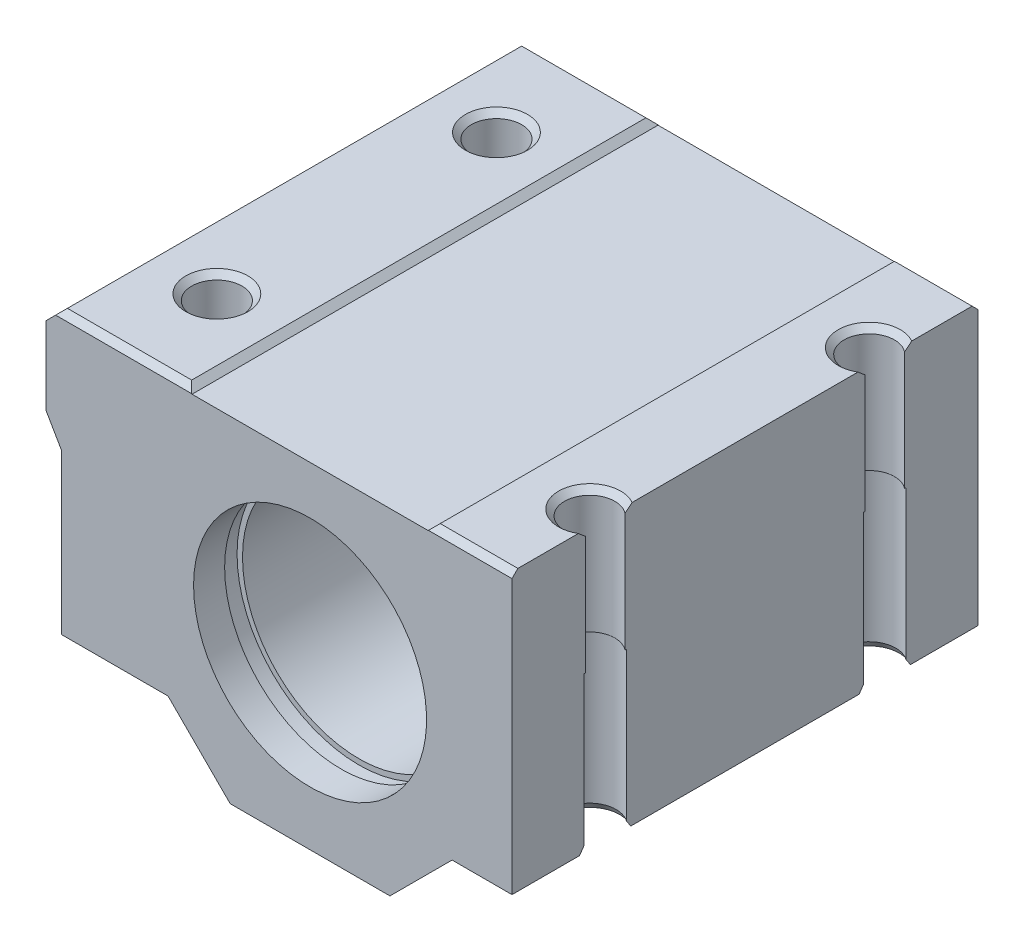
from build123d import *
from OCP.BRepFilletAPI import BRepFilletAPI_MakeChamfer

# Parameters (mm, degrees)
SCHIZZO1_W                   = 34
SCHIZZO1_H                   = 30
ESTRUSIONE_ESTRUSIONE1_DEPTH = 22
SCHIZZO2_W                   = 1
SCHIZZO2_H                   = 14.267949192
TAGLIO_ESTRUSIONE1_DEPTH     = 37.193922142
SCHIZZO3_W                   = 10.8571
SCHIZZO3_H                   = 4
TAGLIO_ESTRUSIONE2_DEPTH     = 37.193922142
SCHIZZO4_W                   = 11.8571
SCHIZZO4_H                   = 4
TAGLIO_ESTRUSIONE3_DEPTH     = 37.193922142
SCHIZZO5_W                   = 1
SCHIZZO5_H                   = 10.267949192
TAGLIO_ESTRUSIONE4_DEPTH     = 37.193922142
SCHIZZO6_W                   = 15.2
SCHIZZO6_H                   = 0.4
TAGLIO_ESTRUSIONE5_DEPTH     = 37.193922142
SFORMO1_ANGLE                = 60
SFORMO2_ANGLE                = 60
SFORMO3_ANGLE                = 45
SFORMO4_ANGLE                = 45
SMUSSO1_SIZE                 = 0.230940108
SMUSSO1_SIZE2                = 0.4
SMUSSO2_SIZE                 = 0.379
SMUSSO3_SIZE                 = 1
SCHIZZO13_W                  = 7.577824215
SCHIZZO13_H                  = 21.931685432
TAGLIO_ESTRUSIONE6_DEPTH     = 37.193922142


with BuildPart() as part:
    # Schizzo1 → Estrusione-Estrusione1 (new body)
    with BuildSketch(Plane(origin=(0, 11, 0), x_dir=(1, 0, 0), z_dir=(0, 1, 0))):
        with Locations((0, -15)):
            Rectangle(SCHIZZO1_W, SCHIZZO1_H)
    extrude(amount=-ESTRUSIONE_ESTRUSIONE1_DEPTH)

    # Schizzo2 → Taglio-Estrusione1 (cut, through all)
    with BuildSketch(Plane.XY.offset(30)):
        with Locations((16.5, -3.866025404)):
            Rectangle(SCHIZZO2_W, SCHIZZO2_H)
    extrude(amount=-TAGLIO_ESTRUSIONE1_DEPTH, mode=Mode.SUBTRACT)

    # Schizzo3 → Taglio-Estrusione2 (cut, through all)
    with BuildSketch(Plane.XY.offset(30)):
        with Locations((10.57145, -9)):
            Rectangle(SCHIZZO3_W, SCHIZZO3_H)
    extrude(amount=-TAGLIO_ESTRUSIONE2_DEPTH, mode=Mode.SUBTRACT)

    # Schizzo4 → Taglio-Estrusione3 (cut, through all)
    with BuildSketch(Plane.XY.offset(30)):
        with Locations((-11.07145, -9)):
            Rectangle(SCHIZZO4_W, SCHIZZO4_H)
    extrude(amount=-TAGLIO_ESTRUSIONE3_DEPTH, mode=Mode.SUBTRACT)

    # Schizzo5 → Taglio-Estrusione4 (cut, through all)
    with BuildSketch(Plane.XY.offset(30)):
        with Locations((-16.5, -1.866025404)):
            Rectangle(SCHIZZO5_W, SCHIZZO5_H)
    extrude(amount=-TAGLIO_ESTRUSIONE4_DEPTH, mode=Mode.SUBTRACT)

    # Schizzo6 → Taglio-Estrusione5 (cut, through all)
    with BuildSketch(Plane.XY.offset(30)):
        with Locations((0, 10.8)):
            Rectangle(SCHIZZO6_W, SCHIZZO6_H)
    extrude(amount=-TAGLIO_ESTRUSIONE5_DEPTH, mode=Mode.SUBTRACT)

    # Sformo1
    sformo1_faces = [part.faces().sort_by_distance(p)[0] for p in [
        (16.5, 3.267949192, 15),
    ]]
    draft(sformo1_faces, Plane(origin=(16, 3.267949192, 0), x_dir=(0, 0, 1), z_dir=(1, 0, 0)), SFORMO1_ANGLE)

    # Sformo2
    sformo2_faces = [part.faces().sort_by_distance(p)[0] for p in [
        (-16.5, 3.267949192, 15),
    ]]
    draft(sformo2_faces, Plane(origin=(-16, -7, 0), x_dir=(0, 0, -1), z_dir=(-1, 0, 0)), SFORMO2_ANGLE)

    # Sformo3
    sformo3_faces = [part.faces().sort_by_distance(p)[0] for p in [
        (5.1429, -9, 15),
        (-5.1429, -9, 15),
    ]]
    draft(sformo3_faces, Plane(origin=(0, -11, 0), x_dir=(0, 0, -1), z_dir=(0, -1, 0)), SFORMO3_ANGLE)

    # Sformo4
    sformo4_faces = [part.faces().sort_by_distance(p)[0] for p in [
        (-7.6, 10.8, 15),
        (7.6, 10.8, 15),
    ]]
    draft(sformo4_faces, Plane(origin=(-7.6, 10.6, 0), x_dir=(1, 0, 0), z_dir=(0, 1, 0)), SFORMO4_ANGLE)

    # Schizzo7 → Taglia-Rivoluzione1 (revolve, cut)
    with BuildSketch(Plane.XZ, mode=Mode.PRIVATE) as taglia_rivoluzione1_sk:
        Polygon((7.5, 30), (0, 30), (0, 0), (7.5, 0), (7.5, 2), (7.85, 2), (7.85, 3.15), (7.5, 3.15), (7.5, 26.85), (7.85, 26.85), (7.85, 28), (7.5, 28), align=None)
    revolve(taglia_rivoluzione1_sk.sketch.rotate(Axis((0, 0, 30), (0, 0, -1)), 180), axis=Axis((0, 0, 30), (0, 0, -1)), mode=Mode.SUBTRACT)

    # Schizzo8 → Taglia-Rivoluzione2 (revolve, cut)
    with BuildSketch(Plane.XY.offset(6), mode=Mode.PRIVATE) as taglia_rivoluzione2_sk:
        Polygon((-10.379, 11), (-12, 11), (-12, -7), (-10.3, -7), (-10.3, 3), (-10.379, 3), align=None)
    revolve(taglia_rivoluzione2_sk.sketch.rotate(Axis((-12, 11, 6), (0, -1, 0)), 270), axis=Axis((-12, 11, 6), (0, -1, 0)), mode=Mode.SUBTRACT)

    # Schizzo9 → Taglia-Rivoluzione3 (revolve, cut)
    with BuildSketch(Plane.XY.offset(24), mode=Mode.PRIVATE) as taglia_rivoluzione3_sk:
        Polygon((-10.379, 11), (-12, 11), (-12, -7), (-10.3, -7), (-10.3, 3), (-10.379, 3), align=None)
    revolve(taglia_rivoluzione3_sk.sketch.rotate(Axis((-12, 11, 24), (0, -1, 0)), 270), axis=Axis((-12, 11, 24), (0, -1, 0)), mode=Mode.SUBTRACT)

    # Schizzo10 → Taglia-Rivoluzione4 (revolve, cut)
    with BuildSketch(Plane.XY.offset(6), mode=Mode.PRIVATE) as taglia_rivoluzione4_sk:
        Polygon((13.621, 11), (12, 11), (12, -7), (13.7, -7), (13.7, 3), (13.621, 3), align=None)
    revolve(taglia_rivoluzione4_sk.sketch.rotate(Axis((12, 11, 6), (0, -1, 0)), 270), axis=Axis((12, 11, 6), (0, -1, 0)), mode=Mode.SUBTRACT)

    # Schizzo11 → Taglia-Rivoluzione5 (revolve, cut)
    with BuildSketch(Plane.XY.offset(24), mode=Mode.PRIVATE) as taglia_rivoluzione5_sk:
        Polygon((13.621, 11), (12, 11), (12, -7), (13.7, -7), (13.7, 3), (13.621, 3), align=None)
    revolve(taglia_rivoluzione5_sk.sketch.rotate(Axis((12, 11, 24), (0, -1, 0)), 270), axis=Axis((12, 11, 24), (0, -1, 0)), mode=Mode.SUBTRACT)

    # Smusso1: one chamfer whose edges measure the first distance from different faces: ONE call of the kernel's chamfer builder (chamfer() names one face for all edges)
    smusso1_edges_1 = [part.edges().sort_by_distance(p)[0] for p in [
        (-12, -7, 7.7),
        (-12, -7, 25.7),
    ]]
    smusso1_side_1 = [part.faces().sort_by_distance(p)[0] for p in [
        (-12.626775869, -7, 15),
    ]]
    smusso1_edges_2 = [part.edges().sort_by_distance(p)[0] for p in [
        (12, -7, 7.7),
        (12, -7, 25.7),
    ]]
    smusso1_side_2 = [part.faces().sort_by_distance(p)[0] for p in [
        (12.626775869, -7, 15),
    ]]
    smusso1 = BRepFilletAPI_MakeChamfer(part.part.solid().wrapped)
    for e in smusso1_edges_1:
        smusso1.Add(SMUSSO1_SIZE, SMUSSO1_SIZE2, e.wrapped, smusso1_side_1[0].wrapped)  # the first distance lies on this face
    for e in smusso1_edges_2:
        smusso1.Add(SMUSSO1_SIZE, SMUSSO1_SIZE2, e.wrapped, smusso1_side_2[0].wrapped)  # the first distance lies on this face
    add(Compound.cast(smusso1.Shape()), mode=Mode.REPLACE)

    # Smusso2
    smusso2_edges = [part.edges().sort_by_distance(p)[0] for p in [
        (-12, 11, 7.621),
        (-12, 11, 25.621),
        (12, 11, 7.621),
        (12, 11, 25.621),
        (-12.5, 11, 30),
        (12.5, 11, 0),
        (-12.5, 11, 0),
        (12.5, 11, 30),
    ]]
    chamfer(smusso2_edges, length=SMUSSO2_SIZE)

    # Smusso3
    smusso3_edges = [part.edges().sort_by_distance(p)[0] for p in [
        (17, 11, 15),
        (-17, 11, 15),
    ]]
    chamfer(smusso3_edges, length=SMUSSO3_SIZE)

    # Schizzo13 → Taglio-Estrusione6 (cut, through all)
    with BuildSketch(Plane(origin=(0, 0, 0), x_dir=(-1, 0, 0), z_dir=(0, 0, -1))):
        with Locations((-16.788912107, 1.791699595)):
            Rectangle(SCHIZZO13_W, SCHIZZO13_H)
    extrude(amount=-TAGLIO_ESTRUSIONE6_DEPTH, mode=Mode.SUBTRACT)


solid = part.part
